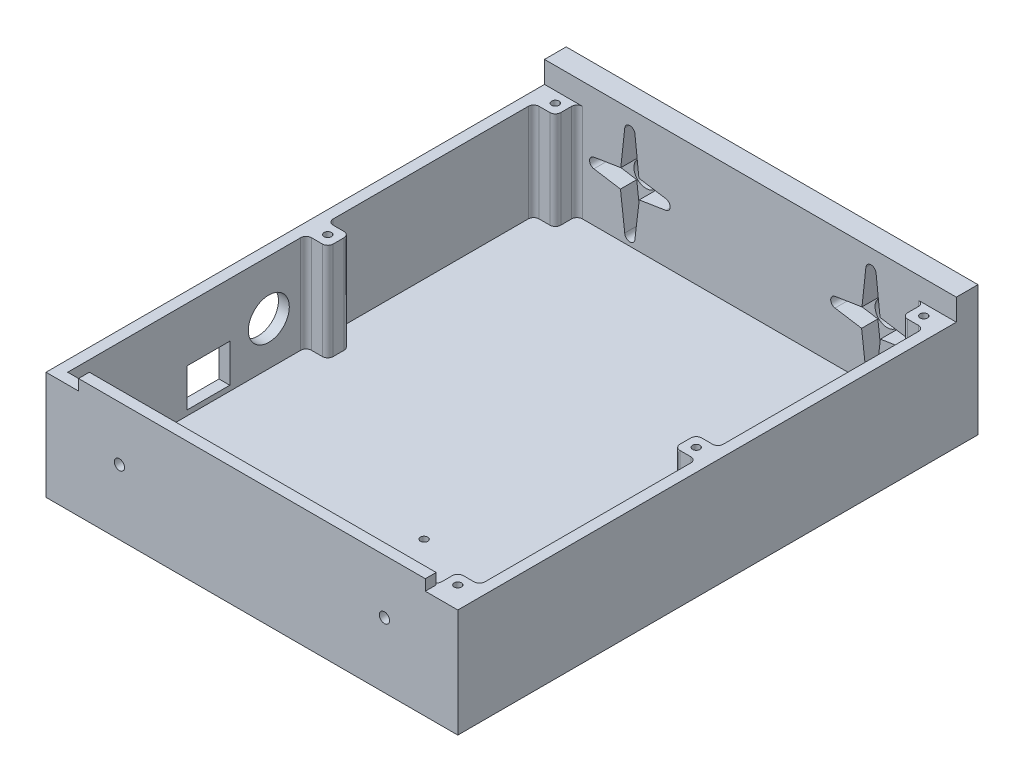
from build123d import *

# Parameters (mm, degrees)
SKETCH1_W                 = 120.65
SKETCH1_H                 = 152.4
BOSS_EXTRUDE1_DEPTH       = 3.175
SKETCH1_3_W               = 120.65
SKETCH1_3_H               = 152.4
SKETCH1_3_W_2             = 114.3
SKETCH1_3_H_2             = 142.875
BOSS_EXTRUDE2_DEPTH       = 38.1
SKETCH2_R                 = 1.5
CUT_EXTRUDE1_DEPTH        = 3.175
SKETCH3_R                 = 3.575
CUT_EXTRUDE8_DEPTH        = 4.7625
CUT_EXTRUDE9_DEPTH        = 163.546356849
CUT_EXTRUDE10_REACH       = 147.115
SKETCH4_R                 = 6
SKETCH4_W                 = 12.5
SKETCH4_H                 = 11.176
F_2_CLEARANCE_HOLE1_D     = 2.159
CUT_EXTRUDE11_DEPTH       = 3.175
SKETCH8_6_W               = 6.35
SKETCH8_6_H               = 142.875
CUT_EXTRUDE13_DEPTH       = 6.35
SKETCH9_W                 = 6.35
SKETCH9_H                 = 6.35
BOSS_EXTRUDE3_DEPTH       = 28.575
FILLET1_R                 = 1.5875
F_2_CLEARANCE_HOLE2_D     = 2.159
F_2_CLEARANCE_HOLE2_DEPTH = 12.7
F_2_CLEARANCE_HOLE2_TIP   = 0.648629038


with BuildPart() as part:
    # Sketch1 → Boss-Extrude1 (new body)
    with BuildSketch(Plane(origin=(0, 0, 0), x_dir=(1, 0, 0), z_dir=(0, 1, 0))):
        Rectangle(SKETCH1_W, SKETCH1_H)
    extrude(amount=BOSS_EXTRUDE1_DEPTH)

    # Sketch1<3> → Boss-Extrude2 (add)
    with BuildSketch(Plane(origin=(0, 0, 0), x_dir=(1, 0, 0), z_dir=(0, 1, 0))):
        Rectangle(SKETCH1_3_W, SKETCH1_3_H)
        with Locations((0, -1.5875)):
            Rectangle(SKETCH1_3_W_2, SKETCH1_3_H_2, mode=Mode.SUBTRACT)
    extrude(amount=BOSS_EXTRUDE2_DEPTH)

    # Sketch2 → Cut-Extrude1 (cut)
    with BuildSketch(Plane.XY.offset(76.2)):
        with Locations((38.825, 19.05)):
            Circle(SKETCH2_R)
    cut_extrude1 = extrude(amount=-CUT_EXTRUDE1_DEPTH, mode=Mode.SUBTRACT)

    # Sketch3 → Cut-Extrude8 (cut)
    with BuildSketch(Plane.XY.offset(-69.85)):
        with BuildLine():
            Line((33.833736344, 32.461656111), (32.677171347, 21.792446302))
            Line((32.677171347, 21.792446302), (24.788193615, 20.531189635))
            ThreePointArc((24.788193615, 20.531189635), (23.525, 19.05), (24.788193615, 17.568810365))
            Line((24.788193615, 17.568810365), (32.573739357, 16.324089971))
            Line((32.573739357, 16.324089971), (33.825, 5.8))
            ThreePointArc((33.825, 5.8), (35.325, 4.3), (36.825, 5.8))
            Line((36.825, 5.8), (38.076260643, 16.324089971))
            Line((38.076260643, 16.324089971), (45.861806385, 17.568810365))
            ThreePointArc((45.861806385, 17.568810365), (47.125, 19.05), (45.861806385, 20.531189635))
            Line((45.861806385, 20.531189635), (37.972828653, 21.792446302))
            Line((37.972828653, 21.792446302), (36.816263656, 32.461656111))
            ThreePointArc((36.816263656, 32.461656111), (35.325, 33.799999964), (33.833736344, 32.461656111))
        make_face()
        with Locations((35.325, 19.05)):
            Circle(SKETCH3_R, mode=Mode.SUBTRACT)
    cut_extrude8 = extrude(amount=-CUT_EXTRUDE8_DEPTH, mode=Mode.SUBTRACT)

    # Sketch3<8> → Cut-Extrude9 (cut, through all)
    with BuildSketch(Plane.XY.offset(-69.85)):
        with BuildLine():
            ThreePointArc((37.53121275, 16.23695), (37.852906743, 16.522093257), (38.13805, 16.84378725))
            ThreePointArc((38.13805, 16.84378725), (38.704147729, 17.882958602), (38.9, 19.05))
            ThreePointArc((38.9, 19.05), (38.671402302, 20.307861928), (38.014843843, 21.40485989))
            ThreePointArc((38.014843843, 21.40485989), (37.783724686, 21.645245252), (37.53121275, 21.86305))
            ThreePointArc((37.53121275, 21.86305), (35.325, 22.625), (33.11878725, 21.86305))
            ThreePointArc((33.11878725, 21.86305), (32.866275314, 21.645245252), (32.635156157, 21.40485989))
            ThreePointArc((32.635156157, 21.40485989), (31.751303585, 19.146534617), (32.51195, 16.84378725))
            ThreePointArc((32.51195, 16.84378725), (32.797093257, 16.522093257), (33.11878725, 16.23695))
            ThreePointArc((33.11878725, 16.23695), (35.325, 15.475), (37.53121275, 16.23695))
        make_face()
    cut_extrude9 = extrude(amount=-CUT_EXTRUDE9_DEPTH, mode=Mode.SUBTRACT)

    # Mirror1: Cut-Extrude1, Cut-Extrude8, Cut-Extrude9 across plane
    add(cut_extrude1.mirror(Plane(origin=(0, 0, 0), x_dir=(0, 0, 1), z_dir=(1, 0, 0))), mode=Mode.SUBTRACT)
    add(cut_extrude8.mirror(Plane(origin=(0, 0, 0), x_dir=(0, 0, 1), z_dir=(1, 0, 0))), mode=Mode.SUBTRACT)
    add(cut_extrude9.mirror(Plane(origin=(0, 0, 0), x_dir=(0, 0, 1), z_dir=(1, 0, 0))), mode=Mode.SUBTRACT)

    # Sketch4 → Cut-Extrude10 (cut, up to next)
    with BuildSketch(Plane(origin=(-57.15, 0, 0), x_dir=(0, 0, -1), z_dir=(1, 0, 0)), mode=Mode.PRIVATE) as cut_extrude10_sk1:
        with Locations((-14.095, 15.876)):
            Circle(SKETCH4_R)
    cut_extrude10_tool1 = extrude(cut_extrude10_sk1.sketch, amount=-CUT_EXTRUDE10_REACH, mode=Mode.PRIVATE) & part.part
    # Sketch4 → Cut-Extrude10 (cut, up to next)
    with BuildSketch(Plane(origin=(-57.15, 0, 0), x_dir=(0, 0, -1), z_dir=(1, 0, 0)), mode=Mode.PRIVATE) as cut_extrude10_sk2:
        with Locations((-31.775, 10.288)):
            Rectangle(SKETCH4_W, SKETCH4_H)
    cut_extrude10_tool2 = extrude(cut_extrude10_sk2.sketch, amount=-CUT_EXTRUDE10_REACH, mode=Mode.PRIVATE) & part.part
    add(cut_extrude10_tool1.solids().sort_by_distance((-57.15, 15.876, 14.095))[0], mode=Mode.SUBTRACT)
    add(cut_extrude10_tool2.solids().sort_by_distance((-57.15, 10.288, 31.775))[0], mode=Mode.SUBTRACT)

    # #2 Clearance Hole1 (through all)
    with Locations(Plane(origin=(8.85, 3.175, 62.6122), x_dir=(0, 0, 1), z_dir=(0, 1, 0))):
        with Locations((0, 0), (-28.0162, 0)):
            Hole(F_2_CLEARANCE_HOLE1_D / 2)

    # Sketch8 → Cut-Extrude11 (cut)
    with BuildSketch(Plane(origin=(0, 38.1, 0), x_dir=(1, 0, 0), z_dir=(0, 1, 0))):
        Polygon((-60.325, 69.85), (-60.325, -76.2), (60.325, -76.2), (60.325, 69.85), (57.15, 69.85), (57.15, -73.025), (-57.15, -73.025), (-57.15, 69.85), align=None)
    extrude(amount=-CUT_EXTRUDE11_DEPTH, mode=Mode.SUBTRACT)

    # Sketch8<6> → Cut-Extrude13 (cut)
    with BuildSketch(Plane(origin=(0, 38.1, 0), x_dir=(1, 0, 0), z_dir=(0, 1, 0))):
        Polygon((-60.325, 69.85), (-60.325, -76.2), (-50.8, -76.2), (-50.8, -73.025), (-57.15, -73.025), (-57.15, 69.85), align=None)
        with Locations((-53.975, -1.5875)):
            Rectangle(SKETCH8_6_W, SKETCH8_6_H)
        with Locations((53.975, -1.5875)):
            Rectangle(SKETCH8_6_W, SKETCH8_6_H)
        Polygon((50.8, -73.025), (50.8, -76.2), (60.325, -76.2), (60.325, 69.85), (57.15, 69.85), (57.15, -73.025), align=None)
    extrude(amount=-CUT_EXTRUDE13_DEPTH, mode=Mode.SUBTRACT)

    # Sketch9 → Boss-Extrude3 (add)
    with BuildSketch(Plane(origin=(0, 3.175, 0), x_dir=(1, 0, 0), z_dir=(0, 1, 0))):
        with Locations((-53.975, 0)):
            Rectangle(SKETCH9_W, SKETCH9_H)
        with Locations((53.975, 0)):
            Rectangle(SKETCH9_W, SKETCH9_H)
        with Locations((53.975, -69.85)):
            Rectangle(SKETCH9_W, SKETCH9_H)
        with Locations((-53.975, 66.675)):
            Rectangle(SKETCH9_W, SKETCH9_H)
        with Locations((53.975, 66.675)):
            Rectangle(SKETCH9_W, SKETCH9_H)
    extrude(amount=BOSS_EXTRUDE3_DEPTH)

    # Fillet1
    fillet1_edges = [part.edges().sort_by_distance(p)[0] for p in [
        (-57.15, 17.4625, -3.175),
        (-57.15, 17.4625, 3.175),
        (-50.8, 17.4625, 3.175),
        (-50.8, 17.4625, -3.175),
        (57.15, 17.4625, 3.175),
        (57.15, 17.4625, -3.175),
        (50.8, 17.4625, -3.175),
        (50.8, 17.4625, 3.175),
        (-57.15, 17.4625, -63.5),
        (-50.8, 17.4625, -63.5),
        (-50.8, 17.4625, -69.85),
        (57.15, 17.4625, 66.675),
        (50.8, 17.4625, 66.675),
        (50.8, 17.4625, 73.025),
        (57.15, 17.4625, -63.5),
        (50.8, 17.4625, -69.85),
        (50.8, 17.4625, -63.5),
    ]]
    fillet(fillet1_edges, radius=FILLET1_R)

    # #2 Clearance Hole2
    with Locations(Plane(origin=(0, 31.75, 0), x_dir=(1, 0, 0), z_dir=(0, 1, 0))):
        with Locations((53.975, 66.675), (53.975, -69.85), (53.975, 0), (-53.975, 0), (-53.975, 66.675)):
            Hole(F_2_CLEARANCE_HOLE2_D / 2, depth=F_2_CLEARANCE_HOLE2_DEPTH)
            with Locations((0, 0, -(F_2_CLEARANCE_HOLE2_DEPTH + F_2_CLEARANCE_HOLE2_TIP / 2))):  # 118° drill point
                Cone(0, F_2_CLEARANCE_HOLE2_D / 2, F_2_CLEARANCE_HOLE2_TIP, mode=Mode.SUBTRACT)


solid = part.part
